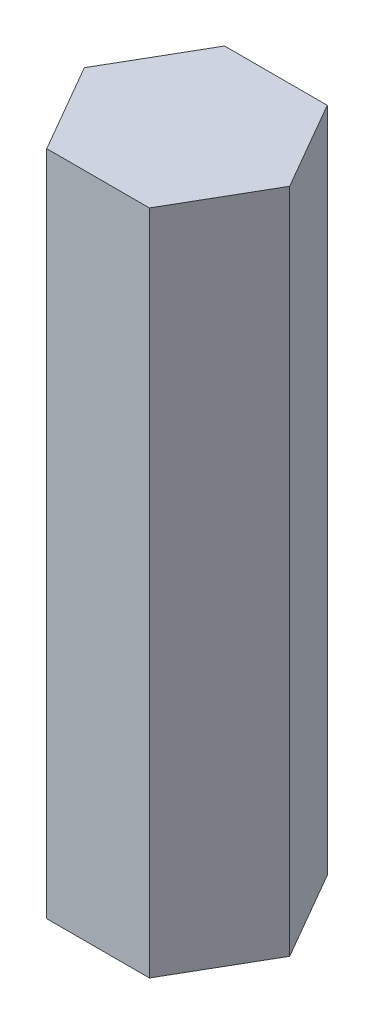
from build123d import *

# Parameters (mm, degrees)
BOSS_EXTRUDE1_DEPTH = 47.625


with BuildPart() as part:
    # Sketch1 → Boss-Extrude1 (new, symmetric)
    with BuildSketch(Plane(origin=(0, 0, 0), x_dir=(1, 0, 0), z_dir=(0, 1, 0))):
        Polygon((-14.664696837, 0), (-7.332348419, -12.7), (7.332348419, -12.7), (14.664696837, 0), (7.332348419, 12.7), (-7.332348419, 12.7), align=None)
    extrude(amount=BOSS_EXTRUDE1_DEPTH, both=True)


solid = part.part
